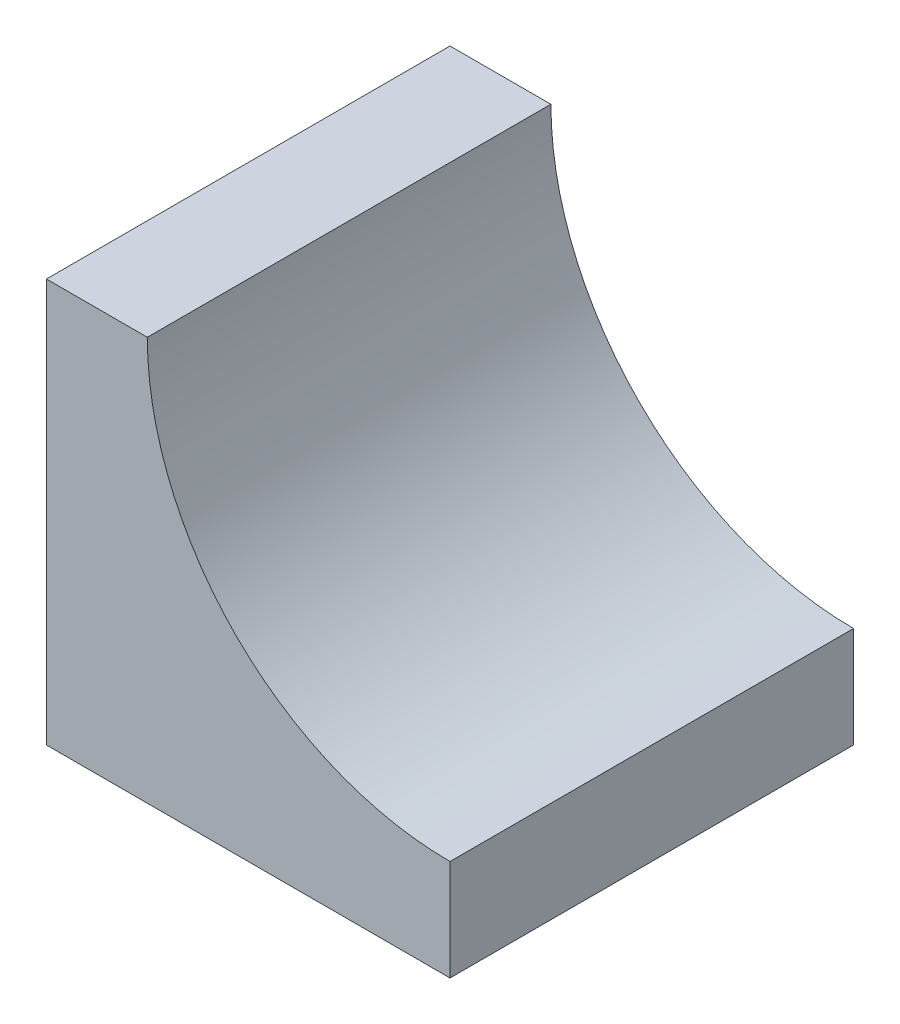
from build123d import *

# Parameters (mm, degrees)
BOSS_EXTRUDE1_DEPTH = 20


with BuildPart() as part:
    # Sketch1 → Boss-Extrude1 (new body)
    with BuildSketch(Plane.XY):
        with BuildLine():
            Line((20, 5), (20, 0))
            Line((20, 0), (0, 0))
            Line((0, 0), (0, 20))
            Line((0, 20), (5, 20))
            ThreePointArc((5, 20), (9.393398282, 9.393398282), (20, 5))
        make_face()
    extrude(amount=BOSS_EXTRUDE1_DEPTH)


solid = part.part
